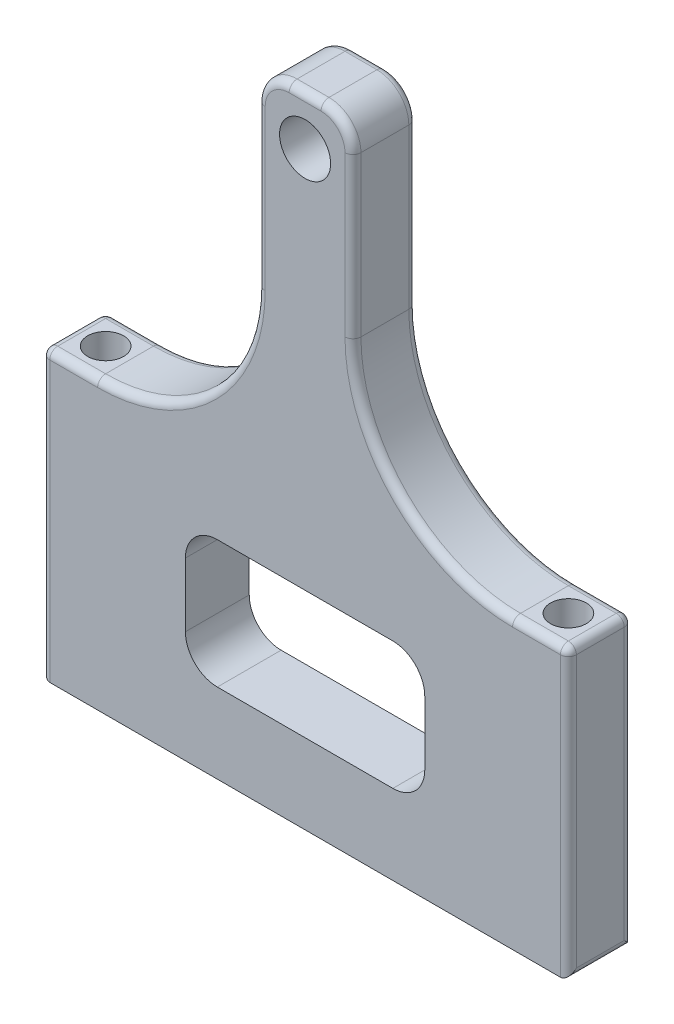
from build123d import *

# Parameters (mm, degrees)
SKETCH1_W           = 15
SKETCH1_H           = 8
SKETCH1_R           = 1.6
BOSS_EXTRUDE1_DEPTH = 2
SKETCH2_R           = 1.125
CUT_EXTRUDE1_DEPTH  = 28.572631358
FILLET2_R           = 10
FILLET3_R           = 2
FILLET6_R           = 2
FILLET5_R           = 0.5


with BuildPart() as part:
    # Sketch1 → Boss-Extrude1 (new, symmetric)
    with BuildSketch(Plane.XY):
        Polygon((-16.5, -9), (16.5, -9), (16.5, 9), (3, 9), (3, 31), (-3, 31), (-3, 9), (-16.5, 9), align=None)
        Rectangle(SKETCH1_W, SKETCH1_H, mode=Mode.SUBTRACT)
        with Locations((0, 27.95)):
            Circle(SKETCH1_R, mode=Mode.SUBTRACT)
    extrude(amount=BOSS_EXTRUDE1_DEPTH, both=True)

    # Sketch2 → Cut-Extrude1 (cut, through all)
    with BuildSketch(Plane(origin=(0, 9, 0), x_dir=(1, 0, 0), z_dir=(0, 1, 0))):
        with Locations(Location((-14.5, 0, 0), (0, 0, 180))):
            Circle(SKETCH2_R)
        with Locations(Location((14.5, 0, 0), (0, 0, 180))):
            Circle(SKETCH2_R)
    extrude(amount=-CUT_EXTRUDE1_DEPTH, mode=Mode.SUBTRACT)

    # Fillet2
    fillet2_edges = [part.edges().sort_by_distance(p)[0] for p in [
        (-3, 9, 0),
        (3, 9, 0),
    ]]
    fillet(fillet2_edges, radius=FILLET2_R)

    # Fillet3
    fillet3_edges = [part.edges().sort_by_distance(p)[0] for p in [
        (-3, 31, 0),
        (3, 31, 0),
    ]]
    fillet(fillet3_edges, radius=FILLET3_R)

    # Fillet6
    fillet6_edges = [part.edges().sort_by_distance(p)[0] for p in [
        (-7.5, 4, 0),
        (-7.5, -4, 0),
        (7.5, -4, 0),
        (7.5, 4, 0),
    ]]
    fillet(fillet6_edges, radius=FILLET6_R)

    # Fillet5
    fillet5_edges = [part.edges().sort_by_distance(p)[0] for p in [
        (16.5, 0, -2),
        (-16.5, 0, -2),
        (16.5, 9, 0),
        (16.5, -9, 0),
        (-16.5, -9, 0),
        (-16.5, 9, 0),
        (16.5, 0, 2),
        (14.75, 9, 2),
        (-14.75, 9, -2),
        (-14.75, 9, 2),
        (3, 24, -2),
        (3, 24, 2),
        (-5.928932188, 11.928932188, -2),
        (-5.928932188, 11.928932188, 2),
        (5.928932188, 11.928932188, -2),
        (5.928932188, 11.928932188, 2),
        (0, 31, -2),
        (0, 31, 2),
        (-3, 24, -2),
        (-2.414213562, 30.414213562, -2),
        (2.414213562, 30.414213562, -2),
        (-3, 24, 2),
        (-2.414213562, 30.414213562, 2),
        (2.414213562, 30.414213562, 2),
        (-16.5, 0, 2),
        (14.75, 9, -2),
    ]]
    fillet(fillet5_edges, radius=FILLET5_R)


solid = part.part
